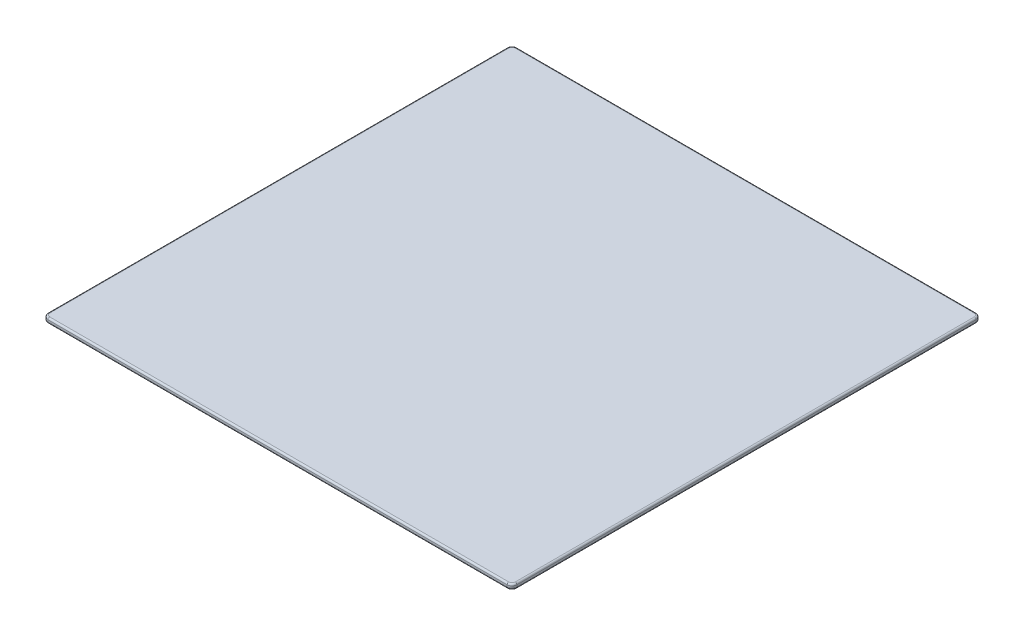
from build123d import *

# Parameters (mm, degrees)
SKETCH2_W           = 285.75
SKETCH2_H           = 285.75
BOSS_EXTRUDE1_DEPTH = 3.175
FILLET1_R           = 3
FILLET2_R           = 1
FILLET3_R           = 1


with BuildPart() as part:
    # Sketch2 → Boss-Extrude1 (new body)
    with BuildSketch(Plane(origin=(0, 0, 0), x_dir=(1, 0, 0), z_dir=(0, 1, 0))):
        Rectangle(SKETCH2_W, SKETCH2_H)
    extrude(amount=BOSS_EXTRUDE1_DEPTH)

    # Fillet1
    fillet1_edges = [part.edges().sort_by_distance(p)[0] for p in [
        (142.875, 1.5875, 142.875),
        (-142.875, 1.5875, 142.875),
        (-142.875, 1.5875, -142.875),
        (142.875, 1.5875, -142.875),
    ]]
    fillet(fillet1_edges, radius=FILLET1_R)

    # Fillet2
    fillet2_edges = [part.edges().sort_by_distance(p)[0] for p in [
        (0, 3.175, -142.875),
        (142.875, 3.175, 0),
        (-142.875, 3.175, 0),
        (0, 3.175, 142.875),
        (-141.996320344, 3.175, -141.996320344),
        (-141.996320344, 3.175, 141.996320344),
        (141.996320344, 3.175, 141.996320344),
        (141.996320344, 3.175, -141.996320344),
    ]]
    fillet(fillet2_edges, radius=FILLET2_R)

    # Fillet3
    fillet3_edges = [part.edges().sort_by_distance(p)[0] for p in [
        (0, 0, -142.875),
        (142.875, 0, 0),
        (0, 0, 142.875),
        (-142.875, 0, 0),
        (-141.996320344, 0, -141.996320344),
        (-141.996320344, 0, 141.996320344),
        (141.996320344, 0, 141.996320344),
        (141.996320344, 0, -141.996320344),
    ]]
    fillet(fillet3_edges, radius=FILLET3_R)


solid = part.part
